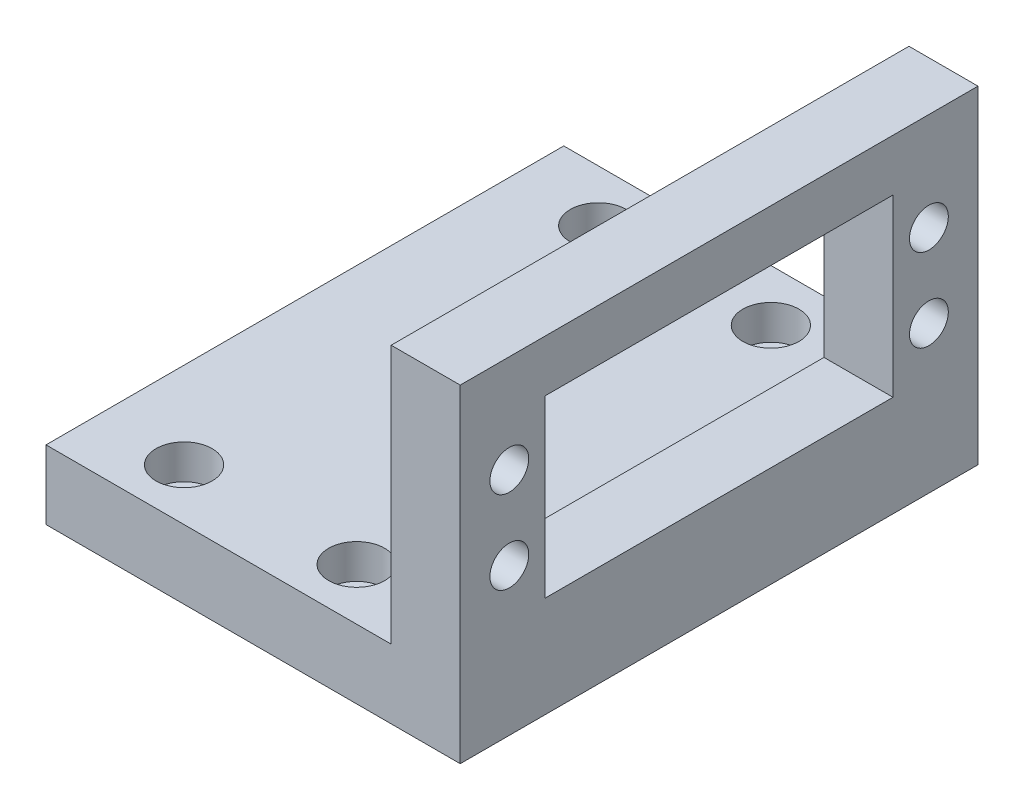
from build123d import *

# Parameters (mm, degrees)
CROQUIS1_W                                 = 40
CROQUIS1_H                                 = 8
SALIENTE_EXTRUIR1_DEPTH                    = 30
CROQUIS2_W                                 = 40.3
CROQUIS2_H                                 = 20.3
CORTAR_EXTRUIR1_DEPTH                      = 60
CROQUIS3_R                                 = 2.25
CROQUIS3_W                                 = 40.3
CROQUIS3_H                                 = 20.3
CORTAR_EXTRUIR2_DEPTH                      = 60
CROQUIS4_R                                 = 3.25
CORTAR_EXTRUIR3_DEPTH                      = 4
TALADRO_DE_MARGEN_PARA_M31_D               = 3.4
TALADRO_DE_MARGEN_PARA_M31_DEPTH           = 11.5
TALADRO_DE_MARGEN_PARA_M31_TIP             = 1.021463052
TALADRO_DE_MARGEN_PARA_M31_ON_FACE_2_D     = 3.4
TALADRO_DE_MARGEN_PARA_M31_ON_FACE_2_DEPTH = 11.5
TALADRO_DE_MARGEN_PARA_M31_ON_FACE_2_TIP   = 1.021463052


with BuildPart() as part:
    # Croquis1 → Saliente-Extruir1 (new, symmetric)
    with BuildSketch(Plane.XY):
        with Locations((-20, -4)):
            Rectangle(CROQUIS1_W, CROQUIS1_H)
        Polygon((0, 30), (0, 0), (0, -8), (8, -8), (8, 30), align=None)
    extrude(amount=SALIENTE_EXTRUIR1_DEPTH, both=True)

    # Croquis2 → Cortar-Extruir1 (cut)
    with BuildSketch(Plane(origin=(8, 0, 0), x_dir=(0, 0, -1), z_dir=(1, 0, 0))):
        with Locations((0, 13.85)):
            Rectangle(CROQUIS2_W, CROQUIS2_H)
    extrude(amount=-CORTAR_EXTRUIR1_DEPTH, mode=Mode.SUBTRACT)

    # Croquis3 → Cortar-Extruir2 (cut)
    with BuildSketch(Plane(origin=(8, 0, 0), x_dir=(0, 0, -1), z_dir=(1, 0, 0))):
        with Locations(Location((-24.31, 18.65, 0), (0, 0, 90))):
            Circle(CROQUIS3_R)
        with Locations(Location((-24.31, 9.05, 0), (0, 0, 270))):
            Circle(CROQUIS3_R)
        with Locations(Location((24.31, 9.05, 0), (0, 0, 90))):
            Circle(CROQUIS3_R)
        with Locations(Location((24.31, 18.65, 0), (0, 0, 270))):
            Circle(CROQUIS3_R)
        with Locations((0, 13.85)):
            Rectangle(CROQUIS3_W, CROQUIS3_H)
    extrude(amount=-CORTAR_EXTRUIR2_DEPTH, mode=Mode.SUBTRACT)

    # Croquis4 → Cortar-Extruir3 (cut)
    with BuildSketch(Plane(origin=(0, 0, 0), x_dir=(1, 0, 0), z_dir=(0, 1, 0))):
        with Locations(Location((-30, 24, 0), (0, 0, 180))):
            Circle(CROQUIS4_R)
        with Locations((-10, 24)):
            Circle(CROQUIS4_R)
        with Locations(Location((-10, -24, 0), (0, 0, 180))):
            Circle(CROQUIS4_R)
        with Locations((-30, -24)):
            Circle(CROQUIS4_R)
    extrude(amount=-CORTAR_EXTRUIR3_DEPTH, mode=Mode.SUBTRACT)

    # Taladro de margen para M31
    with Locations(Plane(origin=(-30, -4, -24), x_dir=(1, 0, 0), z_dir=(0, 1, 0))):
        with Locations((0, 0), (20, 0), (0, -48)):
            Hole(TALADRO_DE_MARGEN_PARA_M31_D / 2, depth=TALADRO_DE_MARGEN_PARA_M31_DEPTH)
            with Locations((0, 0, -(TALADRO_DE_MARGEN_PARA_M31_DEPTH + TALADRO_DE_MARGEN_PARA_M31_TIP / 2))):  # 118° drill point
                Cone(0, TALADRO_DE_MARGEN_PARA_M31_D / 2, TALADRO_DE_MARGEN_PARA_M31_TIP, mode=Mode.SUBTRACT)

    # Taladro de margen para M31 on face 2
    with Locations(Plane(origin=(-10, 0, 24), x_dir=(1, 0, 0), z_dir=(0, 1, 0))):
        with Locations((0, 0)):
            Hole(TALADRO_DE_MARGEN_PARA_M31_ON_FACE_2_D / 2, depth=TALADRO_DE_MARGEN_PARA_M31_ON_FACE_2_DEPTH)
            with Locations((0, 0, -(TALADRO_DE_MARGEN_PARA_M31_ON_FACE_2_DEPTH + TALADRO_DE_MARGEN_PARA_M31_ON_FACE_2_TIP / 2))):  # 118° drill point
                Cone(0, TALADRO_DE_MARGEN_PARA_M31_ON_FACE_2_D / 2, TALADRO_DE_MARGEN_PARA_M31_ON_FACE_2_TIP, mode=Mode.SUBTRACT)


solid = part.part
